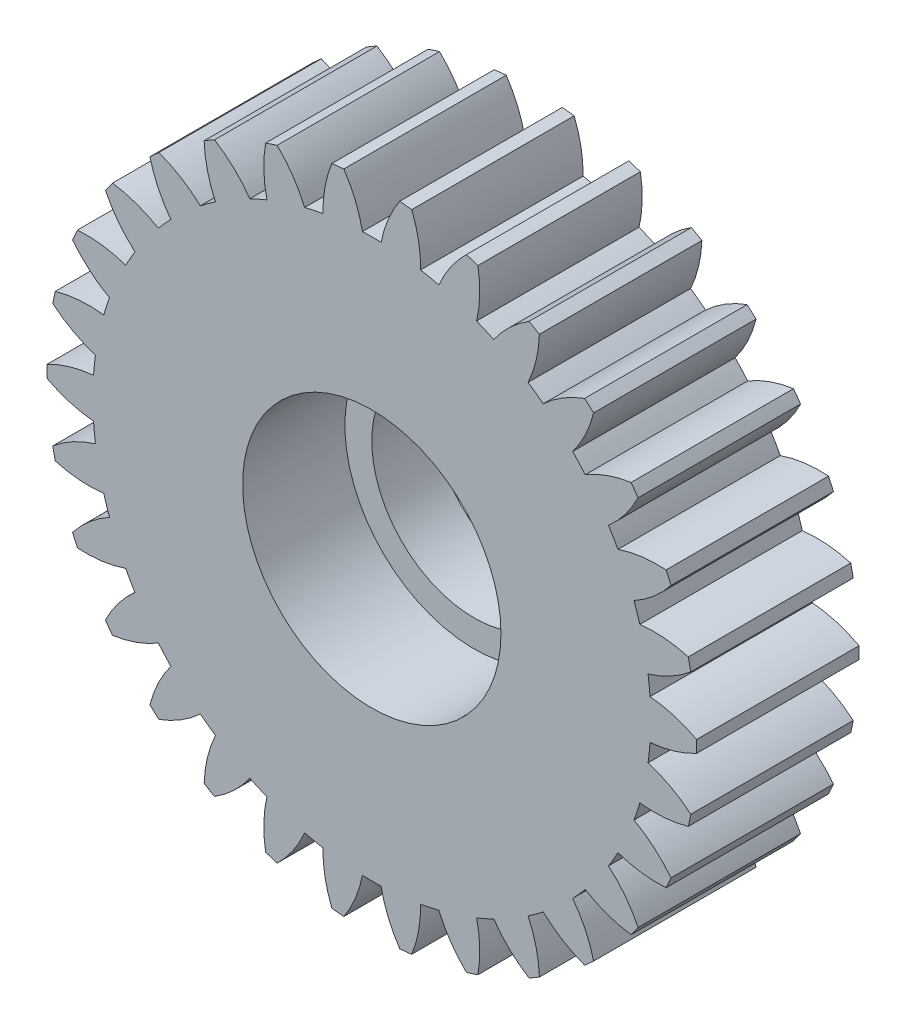
from build123d import *

# Parameters (mm, degrees)
BOSS_EXTRUDE1_DEPTH = 6.35
SKETCH2_R           = 5.05
CUT_EXTRUDE1_DEPTH  = 4
SKETCH3_R           = 4
CUT_EXTRUDE2_DEPTH  = 19.368047939


with BuildPart() as part:
    # Sketch1 → Boss-Extrude1 (new body)
    with BuildSketch(Plane.XY):
        with BuildLine():
            ThreePointArc((-12.697816386, -0.235497422), (-11.813791763, -0.59738778), (-10.875329548, -0.77558103))
            ThreePointArc((-10.875329548, -0.77558103), (-10.843222499, -1.139668609), (-10.798929867, -1.502475431))
            ThreePointArc((-10.798929867, -1.502475431), (-11.679835972, -1.871891997), (-12.469301299, -2.409673236))
            ThreePointArc((-12.469301299, -2.409673236), (-12.422474529, -2.640478473), (-12.371375965, -2.870375713))
            ThreePointArc((-12.371375965, -2.870375713), (-11.431428165, -3.040558844), (-10.476425141, -3.019740878))
            ThreePointArc((-10.476425141, -3.019740878), (-10.369321644, -3.369196839), (-10.250565133, -3.714866506))
            ThreePointArc((-10.250565133, -3.714866506), (-11.035415303, -4.259361111), (-11.695817912, -4.949529611))
            ThreePointArc((-11.695817912, -4.949529611), (-11.602027312, -5.165555367), (-11.50424705, -5.379804811))
            ThreePointArc((-11.50424705, -5.379804811), (-10.549456303, -5.350842896), (-9.619650684, -5.131923559))
            ThreePointArc((-9.619650684, -5.131923559), (-9.442231676, -5.451475), (-9.254201515, -5.764900088))
            ThreePointArc((-9.254201515, -5.764900088), (-9.908694031, -6.460675706), (-10.411171159, -7.273067791))
            ThreePointArc((-10.411171159, -7.273067791), (-10.274515829, -7.464872704), (-10.134327336, -7.654110624))
            ThreePointArc((-10.134327336, -7.654110624), (-9.206422578, -7.427269438), (-8.342451332, -7.019816555))
            ThreePointArc((-8.342451332, -7.019816555), (-8.102470875, -7.295497545), (-7.853384884, -7.562979874))
            ThreePointArc((-7.853384884, -7.562979874), (-8.348915283, -8.379627771), (-8.671506268, -9.278738009))
            ThreePointArc((-8.671506268, -9.278738009), (-8.497958701, -9.437939284), (-8.321488887, -9.593895075))
            ThreePointArc((-8.321488887, -9.593895075), (-7.461024009, -9.179088665), (-6.700646826, -8.600909883))
            ThreePointArc((-6.700646826, -8.600909883), (-6.408593216, -8.820671839), (-6.109337648, -9.030521148))
            ThreePointArc((-6.109337648, -9.030521148), (-6.424248875, -9.932349892), (-6.552854943, -10.878882852))
            ThreePointArc((-6.552854943, -10.878882852), (-6.35, -10.998522628), (-6.144961443, -11.114380274))
            ThreePointArc((-6.144961443, -11.114380274), (-5.389542888, -10.529737672), (-4.765991899, -9.806102178))
            ThreePointArc((-4.765991899, -9.806102178), (-4.434629283, -9.960340447), (-4.098283042, -10.103385314))
            ThreePointArc((-4.098283042, -10.103385314), (-4.218811964, -11.050980662), (-4.147812412, -12.003568311))
            ThreePointArc((-4.147812412, -12.003568311), (-3.924515829, -12.078417757), (-3.699869697, -12.149113722))
            ThreePointArc((-3.699869697, -12.149113722), (-3.082512882, -11.420186615), (-2.623040257, -10.582720752))
            ThreePointArc((-2.623040257, -10.582720752), (-2.266850769, -10.664694383), (-1.908113801, -10.734683061))
            ThreePointArc((-1.908113801, -10.734683061), (-1.828992725, -11.686630549), (-1.561490576, -12.603640235))
            ThreePointArc((-1.561490576, -12.603640235), (-1.327511483, -12.630428071), (-1.093075891, -12.652872603))
            ThreePointArc((-1.093075891, -12.652872603), (-0.640762271, -11.811518602), (-0.365449169, -10.896823648))
            ThreePointArc((-0.365449169, -10.896823648), (0, -10.90295), (0.365449169, -10.896823648))
            ThreePointArc((0.365449169, -10.896823648), (0.640762271, -11.811518602), (1.093075891, -12.652872603))
            ThreePointArc((1.093075891, -12.652872603), (1.327511483, -12.630428071), (1.561490576, -12.603640235))
            ThreePointArc((1.561490576, -12.603640235), (1.828992725, -11.686630549), (1.908113801, -10.734683061))
            ThreePointArc((1.908113801, -10.734683061), (2.266850769, -10.664694383), (2.623040257, -10.582720752))
            ThreePointArc((2.623040257, -10.582720752), (3.082512882, -11.420186615), (3.699869697, -12.149113722))
            ThreePointArc((3.699869697, -12.149113722), (3.924515829, -12.078417757), (4.147812412, -12.003568311))
            ThreePointArc((4.147812412, -12.003568311), (4.218811964, -11.050980662), (4.098283042, -10.103385314))
            ThreePointArc((4.098283042, -10.103385314), (4.434629283, -9.960340447), (4.765991899, -9.806102178))
            ThreePointArc((4.765991899, -9.806102178), (5.389542888, -10.529737672), (6.144961443, -11.114380274))
            ThreePointArc((6.144961443, -11.114380274), (6.35, -10.998522628), (6.552854943, -10.878882852))
            ThreePointArc((6.552854943, -10.878882852), (6.424248875, -9.932349892), (6.109337648, -9.030521148))
            ThreePointArc((6.109337648, -9.030521148), (6.408593216, -8.820671839), (6.700646826, -8.600909883))
            ThreePointArc((6.700646826, -8.600909883), (7.461024009, -9.179088665), (8.321488887, -9.593895075))
            ThreePointArc((8.321488887, -9.593895075), (8.497958701, -9.437939284), (8.671506268, -9.278738009))
            ThreePointArc((8.671506268, -9.278738009), (8.348915283, -8.379627771), (7.853384884, -7.562979874))
            ThreePointArc((7.853384884, -7.562979874), (8.102470875, -7.295497545), (8.342451332, -7.019816555))
            ThreePointArc((8.342451332, -7.019816555), (9.206422578, -7.427269438), (10.134327336, -7.654110624))
            ThreePointArc((10.134327336, -7.654110624), (10.274515829, -7.464872704), (10.411171159, -7.273067791))
            ThreePointArc((10.411171159, -7.273067791), (9.908694031, -6.460675706), (9.254201515, -5.764900088))
            ThreePointArc((9.254201515, -5.764900088), (9.442231676, -5.451475), (9.619650684, -5.131923559))
            ThreePointArc((9.619650684, -5.131923559), (10.549456303, -5.350842896), (11.50424705, -5.379804811))
            ThreePointArc((11.50424705, -5.379804811), (11.602027312, -5.165555367), (11.695817912, -4.949529611))
            ThreePointArc((11.695817912, -4.949529611), (11.035415303, -4.259361111), (10.250565133, -3.714866506))
            ThreePointArc((10.250565133, -3.714866506), (10.369321644, -3.369196839), (10.476425141, -3.019740878))
            ThreePointArc((10.476425141, -3.019740878), (11.431428165, -3.040558844), (12.371375965, -2.870375713))
            ThreePointArc((12.371375965, -2.870375713), (12.422474529, -2.640478473), (12.469301299, -2.409673236))
            ThreePointArc((12.469301299, -2.409673236), (11.679835972, -1.871891997), (10.798929867, -1.502475431))
            ThreePointArc((10.798929867, -1.502475431), (10.843222499, -1.139668609), (10.875329548, -0.77558103))
            ThreePointArc((10.875329548, -0.77558103), (11.813791763, -0.59738778), (12.697816386, -0.235497422))
            ThreePointArc((12.697816386, -0.235497422), (12.7, 0), (12.697816386, 0.235497422))
            ThreePointArc((12.697816386, 0.235497422), (11.813791763, 0.59738778), (10.875329548, 0.77558103))
            ThreePointArc((10.875329548, 0.77558103), (10.843222499, 1.139668609), (10.798929867, 1.502475431))
            ThreePointArc((10.798929867, 1.502475431), (11.679835972, 1.871891997), (12.469301299, 2.409673236))
            ThreePointArc((12.469301299, 2.409673236), (12.422474529, 2.640478473), (12.371375965, 2.870375713))
            ThreePointArc((12.371375965, 2.870375713), (11.431428165, 3.040558844), (10.476425141, 3.019740878))
            ThreePointArc((10.476425141, 3.019740878), (10.369321644, 3.369196839), (10.250565133, 3.714866506))
            ThreePointArc((10.250565133, 3.714866506), (11.035415303, 4.259361111), (11.695817912, 4.949529611))
            ThreePointArc((11.695817912, 4.949529611), (11.602027312, 5.165555367), (11.50424705, 5.379804811))
            ThreePointArc((11.50424705, 5.379804811), (10.549456303, 5.350842896), (9.619650684, 5.131923559))
            ThreePointArc((9.619650684, 5.131923559), (9.442231676, 5.451475), (9.254201515, 5.764900088))
            ThreePointArc((9.254201515, 5.764900088), (9.908694031, 6.460675706), (10.411171159, 7.273067791))
            ThreePointArc((10.411171159, 7.273067791), (10.274515829, 7.464872704), (10.134327336, 7.654110624))
            ThreePointArc((10.134327336, 7.654110624), (9.206422578, 7.427269438), (8.342451332, 7.019816555))
            ThreePointArc((8.342451332, 7.019816555), (8.102470875, 7.295497545), (7.853384884, 7.562979874))
            ThreePointArc((7.853384884, 7.562979874), (8.348915283, 8.379627771), (8.671506268, 9.278738009))
            ThreePointArc((8.671506268, 9.278738009), (8.497958701, 9.437939284), (8.321488887, 9.593895075))
            ThreePointArc((8.321488887, 9.593895075), (7.461024009, 9.179088665), (6.700646826, 8.600909883))
            ThreePointArc((6.700646826, 8.600909883), (6.408593216, 8.820671839), (6.109337648, 9.030521148))
            ThreePointArc((6.109337648, 9.030521148), (6.424248875, 9.932349892), (6.552854943, 10.878882852))
            ThreePointArc((6.552854943, 10.878882852), (6.35, 10.998522628), (6.144961443, 11.114380274))
            ThreePointArc((6.144961443, 11.114380274), (5.389542888, 10.529737672), (4.765991899, 9.806102178))
            ThreePointArc((4.765991899, 9.806102178), (4.434629283, 9.960340447), (4.098283042, 10.103385314))
            ThreePointArc((4.098283042, 10.103385314), (4.218811964, 11.050980662), (4.147812412, 12.003568311))
            ThreePointArc((4.147812412, 12.003568311), (3.924515829, 12.078417757), (3.699869697, 12.149113722))
            ThreePointArc((3.699869697, 12.149113722), (3.082512882, 11.420186615), (2.623040257, 10.582720752))
            ThreePointArc((2.623040257, 10.582720752), (2.266850769, 10.664694383), (1.908113801, 10.734683061))
            ThreePointArc((1.908113801, 10.734683061), (1.828992725, 11.686630549), (1.561490576, 12.603640235))
            ThreePointArc((1.561490576, 12.603640235), (1.327511483, 12.630428071), (1.093075891, 12.652872603))
            ThreePointArc((1.093075891, 12.652872603), (0.640762271, 11.811518602), (0.365449169, 10.896823648))
            ThreePointArc((0.365449169, 10.896823648), (0, 10.90295), (-0.365449169, 10.896823648))
            ThreePointArc((-0.365449169, 10.896823648), (-0.640762271, 11.811518602), (-1.093075891, 12.652872603))
            ThreePointArc((-1.093075891, 12.652872603), (-1.327511483, 12.630428071), (-1.561490576, 12.603640235))
            ThreePointArc((-1.561490576, 12.603640235), (-1.828992725, 11.686630549), (-1.908113801, 10.734683061))
            ThreePointArc((-1.908113801, 10.734683061), (-2.266850769, 10.664694383), (-2.623040257, 10.582720752))
            ThreePointArc((-2.623040257, 10.582720752), (-3.082512882, 11.420186615), (-3.699869697, 12.149113722))
            ThreePointArc((-3.699869697, 12.149113722), (-3.924515829, 12.078417757), (-4.147812412, 12.003568311))
            ThreePointArc((-4.147812412, 12.003568311), (-4.218811964, 11.050980662), (-4.098283042, 10.103385314))
            ThreePointArc((-4.098283042, 10.103385314), (-4.434629283, 9.960340447), (-4.765991899, 9.806102178))
            ThreePointArc((-4.765991899, 9.806102178), (-5.389542888, 10.529737672), (-6.144961443, 11.114380274))
            ThreePointArc((-6.144961443, 11.114380274), (-6.35, 10.998522628), (-6.552854943, 10.878882852))
            ThreePointArc((-6.552854943, 10.878882852), (-6.424248875, 9.932349892), (-6.109337648, 9.030521148))
            ThreePointArc((-6.109337648, 9.030521148), (-6.408593216, 8.820671839), (-6.700646826, 8.600909883))
            ThreePointArc((-6.700646826, 8.600909883), (-7.461024009, 9.179088665), (-8.321488887, 9.593895075))
            ThreePointArc((-8.321488887, 9.593895075), (-8.497958701, 9.437939284), (-8.671506268, 9.278738009))
            ThreePointArc((-8.671506268, 9.278738009), (-8.348915283, 8.379627771), (-7.853384884, 7.562979874))
            ThreePointArc((-7.853384884, 7.562979874), (-8.102470875, 7.295497545), (-8.342451332, 7.019816555))
            ThreePointArc((-8.342451332, 7.019816555), (-9.206422578, 7.427269438), (-10.134327336, 7.654110624))
            ThreePointArc((-10.134327336, 7.654110624), (-10.274515829, 7.464872704), (-10.411171159, 7.273067791))
            ThreePointArc((-10.411171159, 7.273067791), (-9.908694031, 6.460675706), (-9.254201515, 5.764900088))
            ThreePointArc((-9.254201515, 5.764900088), (-9.442231676, 5.451475), (-9.619650684, 5.131923559))
            ThreePointArc((-9.619650684, 5.131923559), (-10.549456303, 5.350842896), (-11.50424705, 5.379804811))
            ThreePointArc((-11.50424705, 5.379804811), (-11.602027312, 5.165555367), (-11.695817912, 4.949529611))
            ThreePointArc((-11.695817912, 4.949529611), (-11.035415303, 4.259361111), (-10.250565133, 3.714866506))
            ThreePointArc((-10.250565133, 3.714866506), (-10.369321644, 3.369196839), (-10.476425141, 3.019740878))
            ThreePointArc((-10.476425141, 3.019740878), (-11.431428165, 3.040558844), (-12.371375965, 2.870375713))
            ThreePointArc((-12.371375965, 2.870375713), (-12.422474529, 2.640478473), (-12.469301299, 2.409673236))
            ThreePointArc((-12.469301299, 2.409673236), (-11.679835972, 1.871891997), (-10.798929867, 1.502475431))
            ThreePointArc((-10.798929867, 1.502475431), (-10.843222499, 1.139668609), (-10.875329548, 0.77558103))
            ThreePointArc((-10.875329548, 0.77558103), (-11.813791763, 0.59738778), (-12.697816386, 0.235497422))
            ThreePointArc((-12.697816386, 0.235497422), (-12.7, 0), (-12.697816386, -0.235497422))
        make_face()
    extrude(amount=BOSS_EXTRUDE1_DEPTH)

    # Sketch2 → Cut-Extrude1 (cut)
    with BuildSketch(Plane.XY.offset(6.35)):
        Circle(SKETCH2_R)
    extrude(amount=-CUT_EXTRUDE1_DEPTH, mode=Mode.SUBTRACT)

    # Sketch3 → Cut-Extrude2 (cut, through all)
    with BuildSketch(Plane.XY.offset(2.35)):
        Circle(SKETCH3_R)
    extrude(amount=-CUT_EXTRUDE2_DEPTH, mode=Mode.SUBTRACT)


solid = part.part
